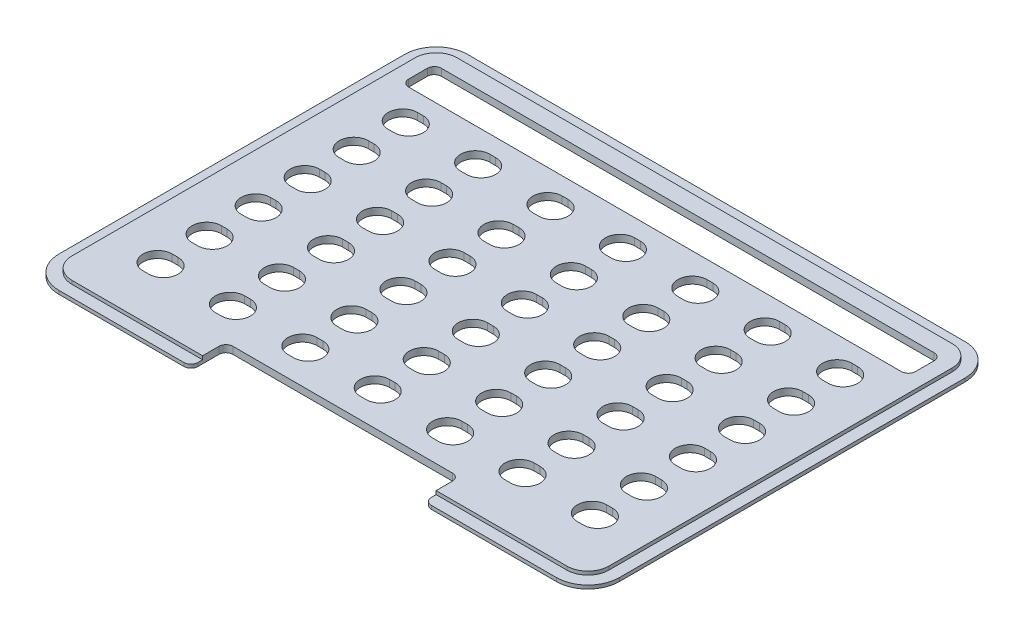
from build123d import *

# Parameters (mm, degrees)
SKETCH1_W                = 240
SKETCH1_H                = 175
OUTER_PROFILE_DEPTH      = 1.5
SKETCH2_W                = 230
SKETCH2_H                = 165
INNER_PROFILE_DEPTH      = 1.5
FILLET1_R                = 9
FILLET2_R                = 13.5
CUTOUT_DEPTH             = 149.543764595
CUTOUTS_COUNT            = 4
CUTOUTS_PITCH            = 31
CUTOUTS_COUNT_DIR2       = 6
CUTOUTS_PITCH_DIR2       = 21
MIRROR1_COPY_1_DEPTH     = 149.543764595
MIRROR1_COPY_2_DEPTH     = 149.543764595
MIRROR1_COPY_3_DEPTH     = 149.543764595
MIRROR1_COPY_4_DEPTH     = 149.543764595
MIRROR1_COPY_5_DEPTH     = 149.543764595
MIRROR1_COPY_6_DEPTH     = 149.543764595
MIRROR1_COPY_7_DEPTH     = 149.543764595
MIRROR1_COPY_8_DEPTH     = 149.543764595
MIRROR1_COPY_9_DEPTH     = 149.543764595
MIRROR1_COPY_10_DEPTH    = 149.543764595
MIRROR1_COPY_11_DEPTH    = 149.543764595
MIRROR1_COPY_12_DEPTH    = 149.543764595
MIRROR1_COPY_13_DEPTH    = 149.543764595
MIRROR1_COPY_14_DEPTH    = 149.543764595
MIRROR1_COPY_15_DEPTH    = 149.543764595
MIRROR1_COPY_16_DEPTH    = 149.543764595
MIRROR1_COPY_17_DEPTH    = 149.543764595
MIRROR1_COPY_18_DEPTH    = 149.543764595
MIRROR1_COPY_19_DEPTH    = 149.543764595
MIRROR1_COPY_20_DEPTH    = 149.543764595
MIRROR1_COPY_21_DEPTH    = 149.543764595
MIRROR1_COPY_22_DEPTH    = 149.543764595
MIRROR1_COPY_23_DEPTH    = 149.543764595
MIRROR1_COPY_24_DEPTH    = 149.543764595
SKETCH4_W                = 217
SKETCH4_H                = 14
MESSAGE_WINDOW_DEPTH     = 149.543764595
MESSAGE_WINDOW_CORNERS_R = 3
SKETCH6_W                = 100
SKETCH6_H                = 15
BASE_CUTBACK_DEPTH       = 149.543764595
FILLET5_R                = 3


with BuildPart() as part:
    # Sketch1 → Outer Profile (new body)
    with BuildSketch(Plane(origin=(0, 0, 0), x_dir=(1, 0, 0), z_dir=(0, 1, 0))):
        Rectangle(SKETCH1_W, SKETCH1_H)
    extrude(amount=OUTER_PROFILE_DEPTH)

    # Sketch2 → Inner Profile (add)
    with BuildSketch(Plane(origin=(0, 1.5, 0), x_dir=(1, 0, 0), z_dir=(0, 1, 0))):
        Rectangle(SKETCH2_W, SKETCH2_H)
    extrude(amount=INNER_PROFILE_DEPTH)

    # Fillet1
    fillet1_edges = [part.edges().sort_by_distance(p)[0] for p in [
        (115, 2.25, 82.5),
        (115, 2.25, -82.5),
        (-115, 2.25, -82.5),
        (-115, 2.25, 82.5),
    ]]
    fillet(fillet1_edges, radius=FILLET1_R)

    # Fillet2
    fillet2_edges = [part.edges().sort_by_distance(p)[0] for p in [
        (120, 0.75, 87.5),
        (-120, 0.75, 87.5),
        (-120, 0.75, -87.5),
        (120, 0.75, -87.5),
    ]]
    fillet(fillet2_edges, radius=FILLET2_R)

    # Sketch3 → Cutout (cut, through all)
    with BuildSketch(Plane(origin=(0, 3, 0), x_dir=(1, 0, 0), z_dir=(0, 1, 0))):
        with BuildLine():
            Line((-1.25, -51.25), (1.25, -51.25))
            ThreePointArc((1.25, -51.25), (7.5, -57.5), (1.25, -63.75))
            Line((1.25, -63.75), (-1.25, -63.75))
            ThreePointArc((-1.25, -63.75), (-7.5, -57.5), (-1.25, -51.25))
        make_face()
    cutout = extrude(amount=-CUTOUT_DEPTH, mode=Mode.SUBTRACT)

    # Cutouts: Cutout 4 × 6
    with Locations(*[(-i * CUTOUTS_PITCH, 0, -j * CUTOUTS_PITCH_DIR2) for i in range(CUTOUTS_COUNT) for j in range(CUTOUTS_COUNT_DIR2) if (i, j) != (0, 0)]):
        add(cutout, mode=Mode.SUBTRACT)

    # Mirror1 copy 1 sketch → Mirror1 copy 1 (cut, through all)
    with BuildSketch(Plane(origin=(0, 3, -21), x_dir=(-1, 0, 0), z_dir=(0, 1, 0))):
        with BuildLine():
            Line((-1.25, 51.25), (1.25, 51.25))
            ThreePointArc((1.25, 51.25), (7.5, 57.5), (1.25, 63.75))
            Line((1.25, 63.75), (-1.25, 63.75))
            ThreePointArc((-1.25, 63.75), (-7.5, 57.5), (-1.25, 51.25))
        make_face()
    extrude(amount=-MIRROR1_COPY_1_DEPTH, mode=Mode.SUBTRACT)

    # Mirror1 copy 2 sketch → Mirror1 copy 2 (cut, through all)
    with BuildSketch(Plane(origin=(0, 3, -42), x_dir=(-1, 0, 0), z_dir=(0, 1, 0))):
        with BuildLine():
            Line((-1.25, 51.25), (1.25, 51.25))
            ThreePointArc((1.25, 51.25), (7.5, 57.5), (1.25, 63.75))
            Line((1.25, 63.75), (-1.25, 63.75))
            ThreePointArc((-1.25, 63.75), (-7.5, 57.5), (-1.25, 51.25))
        make_face()
    extrude(amount=-MIRROR1_COPY_2_DEPTH, mode=Mode.SUBTRACT)

    # Mirror1 copy 3 sketch → Mirror1 copy 3 (cut, through all)
    with BuildSketch(Plane(origin=(0, 3, -63), x_dir=(-1, 0, 0), z_dir=(0, 1, 0))):
        with BuildLine():
            Line((-1.25, 51.25), (1.25, 51.25))
            ThreePointArc((1.25, 51.25), (7.5, 57.5), (1.25, 63.75))
            Line((1.25, 63.75), (-1.25, 63.75))
            ThreePointArc((-1.25, 63.75), (-7.5, 57.5), (-1.25, 51.25))
        make_face()
    extrude(amount=-MIRROR1_COPY_3_DEPTH, mode=Mode.SUBTRACT)

    # Mirror1 copy 4 sketch → Mirror1 copy 4 (cut, through all)
    with BuildSketch(Plane(origin=(0, 3, -84), x_dir=(-1, 0, 0), z_dir=(0, 1, 0))):
        with BuildLine():
            Line((-1.25, 51.25), (1.25, 51.25))
            ThreePointArc((1.25, 51.25), (7.5, 57.5), (1.25, 63.75))
            Line((1.25, 63.75), (-1.25, 63.75))
            ThreePointArc((-1.25, 63.75), (-7.5, 57.5), (-1.25, 51.25))
        make_face()
    extrude(amount=-MIRROR1_COPY_4_DEPTH, mode=Mode.SUBTRACT)

    # Mirror1 copy 5 sketch → Mirror1 copy 5 (cut, through all)
    with BuildSketch(Plane(origin=(0, 3, -105), x_dir=(-1, 0, 0), z_dir=(0, 1, 0))):
        with BuildLine():
            Line((-1.25, 51.25), (1.25, 51.25))
            ThreePointArc((1.25, 51.25), (7.5, 57.5), (1.25, 63.75))
            Line((1.25, 63.75), (-1.25, 63.75))
            ThreePointArc((-1.25, 63.75), (-7.5, 57.5), (-1.25, 51.25))
        make_face()
    extrude(amount=-MIRROR1_COPY_5_DEPTH, mode=Mode.SUBTRACT)

    # Mirror1 copy 6 sketch → Mirror1 copy 6 (cut, through all)
    with BuildSketch(Plane(origin=(31, 3, 0), x_dir=(-1, 0, 0), z_dir=(0, 1, 0))):
        with BuildLine():
            Line((-1.25, 51.25), (1.25, 51.25))
            ThreePointArc((1.25, 51.25), (7.5, 57.5), (1.25, 63.75))
            Line((1.25, 63.75), (-1.25, 63.75))
            ThreePointArc((-1.25, 63.75), (-7.5, 57.5), (-1.25, 51.25))
        make_face()
    extrude(amount=-MIRROR1_COPY_6_DEPTH, mode=Mode.SUBTRACT)

    # Mirror1 copy 7 sketch → Mirror1 copy 7 (cut, through all)
    with BuildSketch(Plane(origin=(31, 3, -21), x_dir=(-1, 0, 0), z_dir=(0, 1, 0))):
        with BuildLine():
            Line((-1.25, 51.25), (1.25, 51.25))
            ThreePointArc((1.25, 51.25), (7.5, 57.5), (1.25, 63.75))
            Line((1.25, 63.75), (-1.25, 63.75))
            ThreePointArc((-1.25, 63.75), (-7.5, 57.5), (-1.25, 51.25))
        make_face()
    extrude(amount=-MIRROR1_COPY_7_DEPTH, mode=Mode.SUBTRACT)

    # Mirror1 copy 8 sketch → Mirror1 copy 8 (cut, through all)
    with BuildSketch(Plane(origin=(31, 3, -42), x_dir=(-1, 0, 0), z_dir=(0, 1, 0))):
        with BuildLine():
            Line((-1.25, 51.25), (1.25, 51.25))
            ThreePointArc((1.25, 51.25), (7.5, 57.5), (1.25, 63.75))
            Line((1.25, 63.75), (-1.25, 63.75))
            ThreePointArc((-1.25, 63.75), (-7.5, 57.5), (-1.25, 51.25))
        make_face()
    extrude(amount=-MIRROR1_COPY_8_DEPTH, mode=Mode.SUBTRACT)

    # Mirror1 copy 9 sketch → Mirror1 copy 9 (cut, through all)
    with BuildSketch(Plane(origin=(31, 3, -63), x_dir=(-1, 0, 0), z_dir=(0, 1, 0))):
        with BuildLine():
            Line((-1.25, 51.25), (1.25, 51.25))
            ThreePointArc((1.25, 51.25), (7.5, 57.5), (1.25, 63.75))
            Line((1.25, 63.75), (-1.25, 63.75))
            ThreePointArc((-1.25, 63.75), (-7.5, 57.5), (-1.25, 51.25))
        make_face()
    extrude(amount=-MIRROR1_COPY_9_DEPTH, mode=Mode.SUBTRACT)

    # Mirror1 copy 10 sketch → Mirror1 copy 10 (cut, through all)
    with BuildSketch(Plane(origin=(31, 3, -84), x_dir=(-1, 0, 0), z_dir=(0, 1, 0))):
        with BuildLine():
            Line((-1.25, 51.25), (1.25, 51.25))
            ThreePointArc((1.25, 51.25), (7.5, 57.5), (1.25, 63.75))
            Line((1.25, 63.75), (-1.25, 63.75))
            ThreePointArc((-1.25, 63.75), (-7.5, 57.5), (-1.25, 51.25))
        make_face()
    extrude(amount=-MIRROR1_COPY_10_DEPTH, mode=Mode.SUBTRACT)

    # Mirror1 copy 11 sketch → Mirror1 copy 11 (cut, through all)
    with BuildSketch(Plane(origin=(31, 3, -105), x_dir=(-1, 0, 0), z_dir=(0, 1, 0))):
        with BuildLine():
            Line((-1.25, 51.25), (1.25, 51.25))
            ThreePointArc((1.25, 51.25), (7.5, 57.5), (1.25, 63.75))
            Line((1.25, 63.75), (-1.25, 63.75))
            ThreePointArc((-1.25, 63.75), (-7.5, 57.5), (-1.25, 51.25))
        make_face()
    extrude(amount=-MIRROR1_COPY_11_DEPTH, mode=Mode.SUBTRACT)

    # Mirror1 copy 12 sketch → Mirror1 copy 12 (cut, through all)
    with BuildSketch(Plane(origin=(62, 3, 0), x_dir=(-1, 0, 0), z_dir=(0, 1, 0))):
        with BuildLine():
            Line((-1.25, 51.25), (1.25, 51.25))
            ThreePointArc((1.25, 51.25), (7.5, 57.5), (1.25, 63.75))
            Line((1.25, 63.75), (-1.25, 63.75))
            ThreePointArc((-1.25, 63.75), (-7.5, 57.5), (-1.25, 51.25))
        make_face()
    extrude(amount=-MIRROR1_COPY_12_DEPTH, mode=Mode.SUBTRACT)

    # Mirror1 copy 13 sketch → Mirror1 copy 13 (cut, through all)
    with BuildSketch(Plane(origin=(62, 3, -21), x_dir=(-1, 0, 0), z_dir=(0, 1, 0))):
        with BuildLine():
            Line((-1.25, 51.25), (1.25, 51.25))
            ThreePointArc((1.25, 51.25), (7.5, 57.5), (1.25, 63.75))
            Line((1.25, 63.75), (-1.25, 63.75))
            ThreePointArc((-1.25, 63.75), (-7.5, 57.5), (-1.25, 51.25))
        make_face()
    extrude(amount=-MIRROR1_COPY_13_DEPTH, mode=Mode.SUBTRACT)

    # Mirror1 copy 14 sketch → Mirror1 copy 14 (cut, through all)
    with BuildSketch(Plane(origin=(62, 3, -42), x_dir=(-1, 0, 0), z_dir=(0, 1, 0))):
        with BuildLine():
            Line((-1.25, 51.25), (1.25, 51.25))
            ThreePointArc((1.25, 51.25), (7.5, 57.5), (1.25, 63.75))
            Line((1.25, 63.75), (-1.25, 63.75))
            ThreePointArc((-1.25, 63.75), (-7.5, 57.5), (-1.25, 51.25))
        make_face()
    extrude(amount=-MIRROR1_COPY_14_DEPTH, mode=Mode.SUBTRACT)

    # Mirror1 copy 15 sketch → Mirror1 copy 15 (cut, through all)
    with BuildSketch(Plane(origin=(62, 3, -63), x_dir=(-1, 0, 0), z_dir=(0, 1, 0))):
        with BuildLine():
            Line((-1.25, 51.25), (1.25, 51.25))
            ThreePointArc((1.25, 51.25), (7.5, 57.5), (1.25, 63.75))
            Line((1.25, 63.75), (-1.25, 63.75))
            ThreePointArc((-1.25, 63.75), (-7.5, 57.5), (-1.25, 51.25))
        make_face()
    extrude(amount=-MIRROR1_COPY_15_DEPTH, mode=Mode.SUBTRACT)

    # Mirror1 copy 16 sketch → Mirror1 copy 16 (cut, through all)
    with BuildSketch(Plane(origin=(62, 3, -84), x_dir=(-1, 0, 0), z_dir=(0, 1, 0))):
        with BuildLine():
            Line((-1.25, 51.25), (1.25, 51.25))
            ThreePointArc((1.25, 51.25), (7.5, 57.5), (1.25, 63.75))
            Line((1.25, 63.75), (-1.25, 63.75))
            ThreePointArc((-1.25, 63.75), (-7.5, 57.5), (-1.25, 51.25))
        make_face()
    extrude(amount=-MIRROR1_COPY_16_DEPTH, mode=Mode.SUBTRACT)

    # Mirror1 copy 17 sketch → Mirror1 copy 17 (cut, through all)
    with BuildSketch(Plane(origin=(62, 3, -105), x_dir=(-1, 0, 0), z_dir=(0, 1, 0))):
        with BuildLine():
            Line((-1.25, 51.25), (1.25, 51.25))
            ThreePointArc((1.25, 51.25), (7.5, 57.5), (1.25, 63.75))
            Line((1.25, 63.75), (-1.25, 63.75))
            ThreePointArc((-1.25, 63.75), (-7.5, 57.5), (-1.25, 51.25))
        make_face()
    extrude(amount=-MIRROR1_COPY_17_DEPTH, mode=Mode.SUBTRACT)

    # Mirror1 copy 18 sketch → Mirror1 copy 18 (cut, through all)
    with BuildSketch(Plane(origin=(93, 3, 0), x_dir=(-1, 0, 0), z_dir=(0, 1, 0))):
        with BuildLine():
            Line((-1.25, 51.25), (1.25, 51.25))
            ThreePointArc((1.25, 51.25), (7.5, 57.5), (1.25, 63.75))
            Line((1.25, 63.75), (-1.25, 63.75))
            ThreePointArc((-1.25, 63.75), (-7.5, 57.5), (-1.25, 51.25))
        make_face()
    extrude(amount=-MIRROR1_COPY_18_DEPTH, mode=Mode.SUBTRACT)

    # Mirror1 copy 19 sketch → Mirror1 copy 19 (cut, through all)
    with BuildSketch(Plane(origin=(93, 3, -21), x_dir=(-1, 0, 0), z_dir=(0, 1, 0))):
        with BuildLine():
            Line((-1.25, 51.25), (1.25, 51.25))
            ThreePointArc((1.25, 51.25), (7.5, 57.5), (1.25, 63.75))
            Line((1.25, 63.75), (-1.25, 63.75))
            ThreePointArc((-1.25, 63.75), (-7.5, 57.5), (-1.25, 51.25))
        make_face()
    extrude(amount=-MIRROR1_COPY_19_DEPTH, mode=Mode.SUBTRACT)

    # Mirror1 copy 20 sketch → Mirror1 copy 20 (cut, through all)
    with BuildSketch(Plane(origin=(93, 3, -42), x_dir=(-1, 0, 0), z_dir=(0, 1, 0))):
        with BuildLine():
            Line((-1.25, 51.25), (1.25, 51.25))
            ThreePointArc((1.25, 51.25), (7.5, 57.5), (1.25, 63.75))
            Line((1.25, 63.75), (-1.25, 63.75))
            ThreePointArc((-1.25, 63.75), (-7.5, 57.5), (-1.25, 51.25))
        make_face()
    extrude(amount=-MIRROR1_COPY_20_DEPTH, mode=Mode.SUBTRACT)

    # Mirror1 copy 21 sketch → Mirror1 copy 21 (cut, through all)
    with BuildSketch(Plane(origin=(93, 3, -63), x_dir=(-1, 0, 0), z_dir=(0, 1, 0))):
        with BuildLine():
            Line((-1.25, 51.25), (1.25, 51.25))
            ThreePointArc((1.25, 51.25), (7.5, 57.5), (1.25, 63.75))
            Line((1.25, 63.75), (-1.25, 63.75))
            ThreePointArc((-1.25, 63.75), (-7.5, 57.5), (-1.25, 51.25))
        make_face()
    extrude(amount=-MIRROR1_COPY_21_DEPTH, mode=Mode.SUBTRACT)

    # Mirror1 copy 22 sketch → Mirror1 copy 22 (cut, through all)
    with BuildSketch(Plane(origin=(93, 3, -84), x_dir=(-1, 0, 0), z_dir=(0, 1, 0))):
        with BuildLine():
            Line((-1.25, 51.25), (1.25, 51.25))
            ThreePointArc((1.25, 51.25), (7.5, 57.5), (1.25, 63.75))
            Line((1.25, 63.75), (-1.25, 63.75))
            ThreePointArc((-1.25, 63.75), (-7.5, 57.5), (-1.25, 51.25))
        make_face()
    extrude(amount=-MIRROR1_COPY_22_DEPTH, mode=Mode.SUBTRACT)

    # Mirror1 copy 23 sketch → Mirror1 copy 23 (cut, through all)
    with BuildSketch(Plane(origin=(93, 3, -105), x_dir=(-1, 0, 0), z_dir=(0, 1, 0))):
        with BuildLine():
            Line((-1.25, 51.25), (1.25, 51.25))
            ThreePointArc((1.25, 51.25), (7.5, 57.5), (1.25, 63.75))
            Line((1.25, 63.75), (-1.25, 63.75))
            ThreePointArc((-1.25, 63.75), (-7.5, 57.5), (-1.25, 51.25))
        make_face()
    extrude(amount=-MIRROR1_COPY_23_DEPTH, mode=Mode.SUBTRACT)

    # Mirror1 copy 24 sketch → Mirror1 copy 24 (cut, through all)
    with BuildSketch(Plane(origin=(0, 3, 0), x_dir=(-1, 0, 0), z_dir=(0, 1, 0))):
        with BuildLine():
            Line((-1.25, 51.25), (1.25, 51.25))
            ThreePointArc((1.25, 51.25), (7.5, 57.5), (1.25, 63.75))
            Line((1.25, 63.75), (-1.25, 63.75))
            ThreePointArc((-1.25, 63.75), (-7.5, 57.5), (-1.25, 51.25))
        make_face()
    extrude(amount=-MIRROR1_COPY_24_DEPTH, mode=Mode.SUBTRACT)

    # Sketch4 → Message Window (cut, through all)
    with BuildSketch(Plane(origin=(0, 3, 0), x_dir=(1, 0, 0), z_dir=(0, 1, 0))):
        with Locations((0, 68.25)):
            Rectangle(SKETCH4_W, SKETCH4_H)
    extrude(amount=-MESSAGE_WINDOW_DEPTH, mode=Mode.SUBTRACT)

    # Message Window Corners
    message_window_corners_edges = [part.edges().sort_by_distance(p)[0] for p in [
        (-108.5, 1.5, -61.25),
        (-108.5, 1.5, -75.25),
        (108.5, 1.5, -75.25),
        (108.5, 1.5, -61.25),
    ]]
    fillet(message_window_corners_edges, radius=MESSAGE_WINDOW_CORNERS_R)

    # Sketch6 → Base Cutback (cut, through all)
    with BuildSketch(Plane(origin=(0, 3, 0), x_dir=(1, 0, 0), z_dir=(0, 1, 0))):
        with Locations((0, -80)):
            Rectangle(SKETCH6_W, SKETCH6_H)
    extrude(amount=-BASE_CUTBACK_DEPTH, mode=Mode.SUBTRACT)

    # Fillet5
    fillet5_edges = [part.edges().sort_by_distance(p)[0] for p in [
        (50, 0.75, 87.5),
        (50, 1.5, 72.5),
        (-50, 0.75, 87.5),
        (-50, 1.5, 72.5),
    ]]
    fillet(fillet5_edges, radius=FILLET5_R)


solid = part.part
